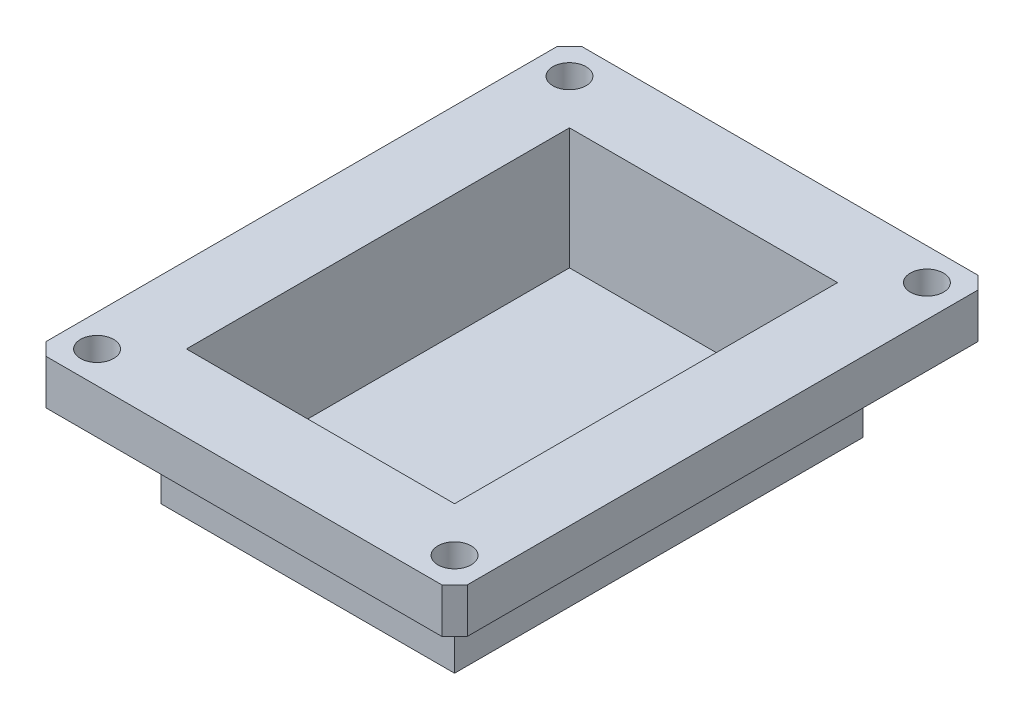
from build123d import *

# Parameters (mm, degrees)
SKETCH1_W           = 105
SKETCH1_H           = 150
SKETCH1_W_2         = 5
SKETCH1_H_2         = 5
BOSS_EXTRUDE1_DEPTH = 35
SKETCH2_W           = 5
SKETCH2_H           = 5
SKETCH2_W_2         = 105
SKETCH2_H_2         = 150
BOSS_EXTRUDE2_DEPTH = 17.5
SKETCH3_W           = 105
SKETCH3_H           = 150
CUT_EXTRUDE1_DEPTH  = 47.5
CUT_EXTRUDE2_REACH  = 176.762
SKETCH4_R           = 6.5
CHAMFER1_SIZE       = 5
CHAMFER2_SIZE       = 5


with BuildPart() as part:
    # Sketch1 → Boss-Extrude1 (new body)
    with BuildSketch(Plane(origin=(0, 0, 0), x_dir=(1, 0, 0), z_dir=(0, 1, 0))):
        Polygon((52.5, -114.8421646), (-52.5, -114.8421646), (-52.5, 35.1578354), (-57.5, 35.1578354), (-57.5, -119.8421646), (52.5, -119.8421646), align=None)
        with Locations((0, -39.8421646)):
            Rectangle(SKETCH1_W, SKETCH1_H)
        Polygon((52.5, 35.1578354), (52.5, -114.8421646), (57.5, -114.8421646), (57.5, 40.1578354), (-52.5, 40.1578354), (-52.5, 35.1578354), align=None)
        with Locations((55, -117.3421646)):
            Rectangle(SKETCH1_W_2, SKETCH1_H_2)
        with Locations((-55, 37.6578354)):
            Rectangle(SKETCH1_W_2, SKETCH1_H_2)
    extrude(amount=BOSS_EXTRUDE1_DEPTH)

    # Sketch2 → Boss-Extrude2 (add)
    with BuildSketch(Plane(origin=(0, 35, 0), x_dir=(1, 0, 0), z_dir=(0, 1, 0))):
        Polygon((-77.5, -139.8421646), (-77.5, 35.1578354), (-77.5, 60.1578354), (-82.5, 60.1578354), (-82.5, -144.8421646), (77.5, -144.8421646), (77.5, -139.8421646), (52.5, -139.8421646), align=None)
        Polygon((-77.5, 60.1578354), (-52.5, 60.1578354), (77.5, 60.1578354), (77.5, -114.8421646), (77.5, -139.8421646), (82.5, -139.8421646), (82.5, 65.1578354), (-77.5, 65.1578354), align=None)
        with Locations((-80, 62.6578354)):
            Rectangle(SKETCH2_W, SKETCH2_H)
        Polygon((-77.5, 35.1578354), (-57.5, 35.1578354), (-57.5, 40.1578354), (-52.5, 40.1578354), (-52.5, 60.1578354), (-77.5, 60.1578354), align=None)
        Polygon((-52.5, 60.1578354), (-52.5, 40.1578354), (57.5, 40.1578354), (57.5, -114.8421646), (77.5, -114.8421646), (77.5, 60.1578354), align=None)
        Polygon((-52.5, 40.1578354), (-52.5, 35.1578354), (52.5, 35.1578354), (52.5, -114.8421646), (57.5, -114.8421646), (57.5, 40.1578354), align=None)
        with Locations((-55, 37.6578354)):
            Rectangle(SKETCH2_W, SKETCH2_H)
        Polygon((-52.5, -114.8421646), (-52.5, 35.1578354), (-57.5, 35.1578354), (-57.5, -119.8421646), (52.5, -119.8421646), (52.5, -114.8421646), align=None)
        Polygon((-57.5, -119.8421646), (-57.5, 35.1578354), (-77.5, 35.1578354), (-77.5, -139.8421646), (52.5, -139.8421646), (52.5, -119.8421646), align=None)
        with Locations((0, -39.8421646)):
            Rectangle(SKETCH2_W_2, SKETCH2_H_2)
        with Locations((55, -117.3421646)):
            Rectangle(SKETCH2_W, SKETCH2_H)
        Polygon((77.5, -114.8421646), (57.5, -114.8421646), (57.5, -119.8421646), (52.5, -119.8421646), (52.5, -139.8421646), (77.5, -139.8421646), align=None)
        with Locations((80, -142.3421646)):
            Rectangle(SKETCH2_W, SKETCH2_H)
    extrude(amount=BOSS_EXTRUDE2_DEPTH)

    # Sketch3 → Cut-Extrude1 (cut)
    with BuildSketch(Plane(origin=(0, 52.5, 0), x_dir=(1, 0, 0), z_dir=(0, 1, 0))):
        with Locations((0, -39.8421646)):
            Rectangle(SKETCH3_W, SKETCH3_H)
    extrude(amount=-CUT_EXTRUDE1_DEPTH, mode=Mode.SUBTRACT)

    # Sketch4 → Cut-Extrude2 (cut, up to next)
    with BuildSketch(Plane(origin=(0, 52.5, 0), x_dir=(1, 0, 0), z_dir=(0, 1, 0)), mode=Mode.PRIVATE) as cut_extrude2_sk1:
        with Locations(Location((-70, 52.6578354, 0), (0, 0, 270))):
            Circle(SKETCH4_R)
    cut_extrude2_tool1 = extrude(cut_extrude2_sk1.sketch, amount=-CUT_EXTRUDE2_REACH, mode=Mode.PRIVATE) & part.part
    # Sketch4 → Cut-Extrude2 (cut, up to next)
    with BuildSketch(Plane(origin=(0, 52.5, 0), x_dir=(1, 0, 0), z_dir=(0, 1, 0)), mode=Mode.PRIVATE) as cut_extrude2_sk2:
        with Locations(Location((-70, -132.3421646, 0), (0, 0, 270))):
            Circle(SKETCH4_R)
    cut_extrude2_tool2 = extrude(cut_extrude2_sk2.sketch, amount=-CUT_EXTRUDE2_REACH, mode=Mode.PRIVATE) & part.part
    # Sketch4 → Cut-Extrude2 (cut, up to next)
    with BuildSketch(Plane(origin=(0, 52.5, 0), x_dir=(1, 0, 0), z_dir=(0, 1, 0)), mode=Mode.PRIVATE) as cut_extrude2_sk3:
        with Locations(Location((70, -132.3421646, 0), (0, 0, 270))):
            Circle(SKETCH4_R)
    cut_extrude2_tool3 = extrude(cut_extrude2_sk3.sketch, amount=-CUT_EXTRUDE2_REACH, mode=Mode.PRIVATE) & part.part
    # Sketch4 → Cut-Extrude2 (cut, up to next)
    with BuildSketch(Plane(origin=(0, 52.5, 0), x_dir=(1, 0, 0), z_dir=(0, 1, 0)), mode=Mode.PRIVATE) as cut_extrude2_sk4:
        with Locations(Location((70, 52.6578354, 0), (0, 0, 270))):
            Circle(SKETCH4_R)
    cut_extrude2_tool4 = extrude(cut_extrude2_sk4.sketch, amount=-CUT_EXTRUDE2_REACH, mode=Mode.PRIVATE) & part.part
    add(cut_extrude2_tool1.solids().sort_by_distance((-70, 52.5, -52.657835))[0], mode=Mode.SUBTRACT)
    add(cut_extrude2_tool2.solids().sort_by_distance((-70, 52.5, 132.342165))[0], mode=Mode.SUBTRACT)
    add(cut_extrude2_tool3.solids().sort_by_distance((70, 52.5, 132.342165))[0], mode=Mode.SUBTRACT)
    add(cut_extrude2_tool4.solids().sort_by_distance((70, 52.5, -52.657835))[0], mode=Mode.SUBTRACT)

    # Chamfer1
    chamfer1_edges = [part.edges().sort_by_distance(p)[0] for p in [
        (0, 35, -40.1578354),
        (-57.5, 35, 39.8421646),
        (0, 35, 119.8421646),
        (57.5, 35, 39.8421646),
    ]]
    chamfer(chamfer1_edges, length=CHAMFER1_SIZE)

    # Chamfer2
    chamfer2_edges = [part.edges().sort_by_distance(p)[0] for p in [
        (82.5, 43.75, 144.8421646),
        (82.5, 43.75, -65.1578354),
        (-82.5, 43.75, -65.1578354),
        (-82.5, 43.75, 144.8421646),
    ]]
    chamfer(chamfer2_edges, length=CHAMFER2_SIZE)


solid = part.part
